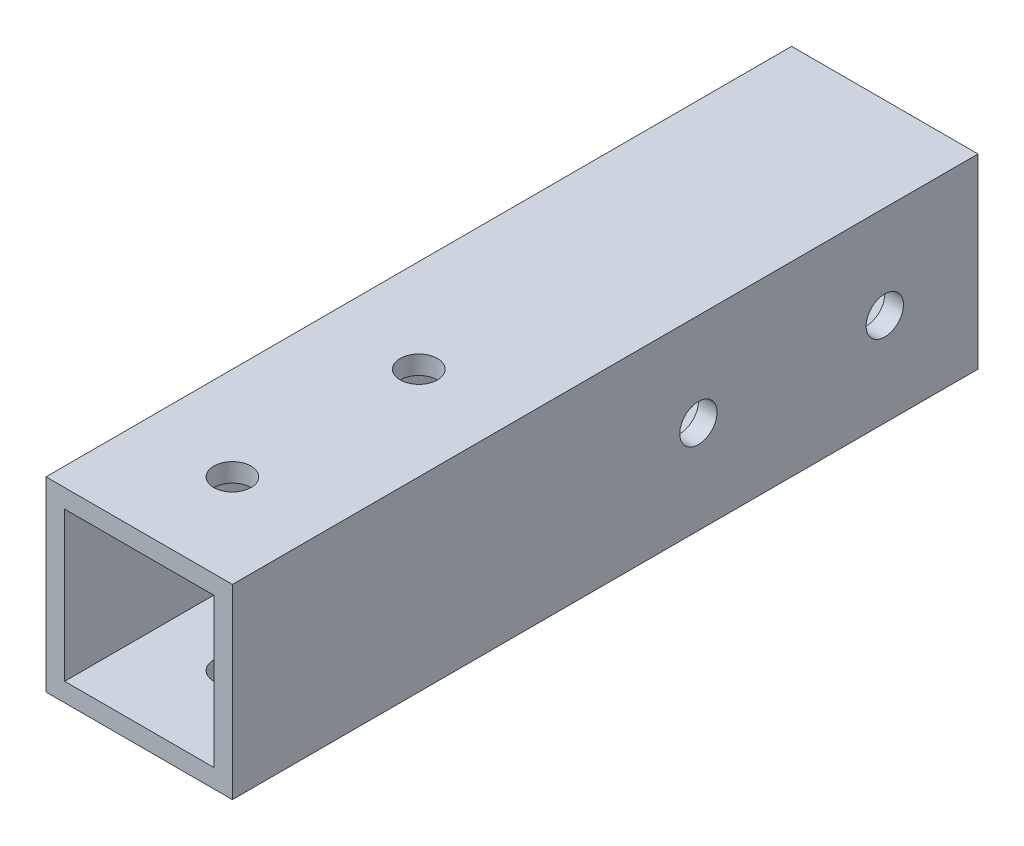
from build123d import *

# Parameters (mm, degrees)
SKETCH_1_W          = 20
SKETCH_1_H          = 20
SKETCH_1_W_2        = 16
SKETCH_1_H_2        = 16
EXTRUDE_1_DEPTH     = 80
SKETCH_2_R          = 2
CUT_EXTRUDE_1_DEPTH = 100
SKETCH_3_R          = 2
CUT_EXTRUDE_2_DEPTH = 100


with BuildPart() as part:
    # 草图1 → 凸台-拉伸1 (new body)
    with BuildSketch(Plane.XY):
        Rectangle(SKETCH_1_W, SKETCH_1_H)
        Rectangle(SKETCH_1_W_2, SKETCH_1_H_2, mode=Mode.SUBTRACT)
    extrude(amount=EXTRUDE_1_DEPTH)

    # 草图2 → 切除-拉伸1 (cut)
    with BuildSketch(Plane(origin=(10, 0, 0), x_dir=(0, 0, -1), z_dir=(1, 0, 0))):
        with Locations((-10, 0)):
            Circle(SKETCH_2_R)
        with Locations((-30, 0)):
            Circle(SKETCH_2_R)
    extrude(amount=-CUT_EXTRUDE_1_DEPTH, mode=Mode.SUBTRACT)

    # 草图3 → 切除-拉伸2 (cut)
    with BuildSketch(Plane.XZ.offset(10)):
        with Locations((0, 50)):
            Circle(SKETCH_3_R)
        with Locations((0, 70)):
            Circle(SKETCH_3_R)
    extrude(amount=-CUT_EXTRUDE_2_DEPTH, mode=Mode.SUBTRACT)


solid = part.part
